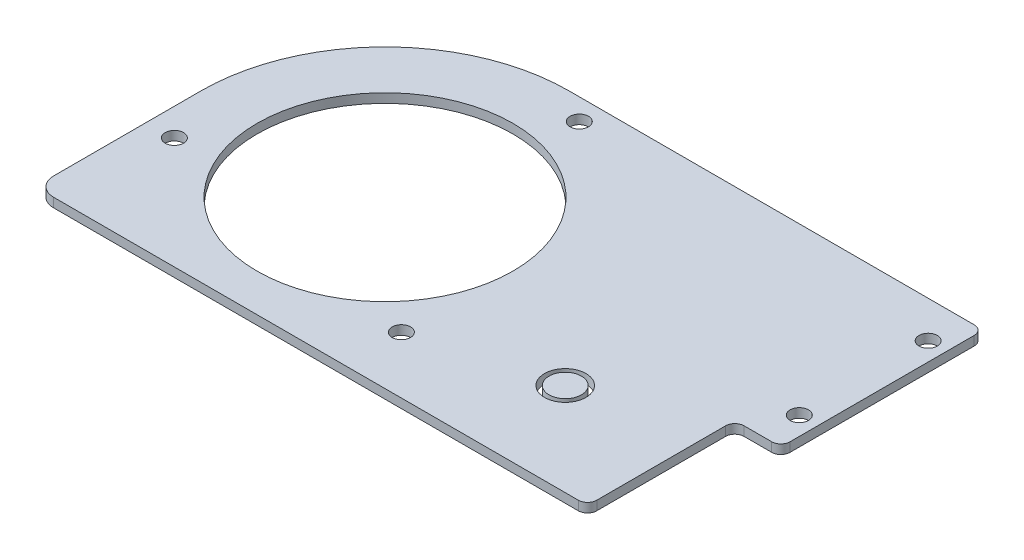
from build123d import *

# Parameters (mm, degrees)
SKETCH1_R           = 88.265
SKETCH1_R_2         = 6.35
BOSS_EXTRUDE1_DEPTH = 6.35
SKETCH6_R           = 14.2875
SKETCH6_R_2         = 11.176
CUT_EXTRUDE1_DEPTH  = 28.448


with BuildPart() as part:
    # Sketch1 → Boss-Extrude1 (new body)
    with BuildSketch(Plane(origin=(0, 0, 0), x_dir=(1, 0, 0), z_dir=(0, 1, 0))):
        with BuildLine():
            Line((279.4, 127), (0, 127))
            ThreePointArc((0, 127), (-89.802561211, 89.802561211), (-127, 0))
            Line((-127, 0), (-127, -101.6))
            ThreePointArc((-127, -101.6), (-123.280256121, -110.580256121), (-114.3, -114.3))
            Line((-114.3, -114.3), (247.65, -114.3))
            ThreePointArc((247.65, -114.3), (252.140128061, -112.440128061), (254, -107.95))
            Line((254, -107.95), (254, -19.05))
            ThreePointArc((254, -19.05), (255.859871939, -14.559871939), (260.35, -12.7))
            Line((260.35, -12.7), (279.4, -12.7))
            ThreePointArc((279.4, -12.7), (283.890128061, -10.840128061), (285.75, -6.35))
            Line((285.75, -6.35), (285.75, 120.65))
            ThreePointArc((285.75, 120.65), (283.890128061, 125.140128061), (279.4, 127))
        make_face()
        with Locations(Location((0, 0, 0), (0, 0, 270))):
            Circle(SKETCH1_R, mode=Mode.SUBTRACT)
        with Locations(Location((-108.072773191, -37.212440054, 0), (0, 0, 270))):
            Circle(SKETCH1_R_2, mode=Mode.SUBTRACT)
        with Locations(Location((21.809468172, 112.199987068, 0), (0, 0, 270))):
            Circle(SKETCH1_R_2, mode=Mode.SUBTRACT)
        with Locations(Location((86.263305019, -74.987547014, 0), (0, 0, 270))):
            Circle(SKETCH1_R_2, mode=Mode.SUBTRACT)
        with Locations(Location((273.05, 101.6, 0), (0, 0, 270))):
            Circle(SKETCH1_R_2, mode=Mode.SUBTRACT)
        with Locations(Location((273.05, 12.7, 0), (0, 0, 270))):
            Circle(SKETCH1_R_2, mode=Mode.SUBTRACT)
    extrude(amount=BOSS_EXTRUDE1_DEPTH)

    # Sketch6 → Cut-Extrude1 (cut)
    with BuildSketch(Plane(origin=(0, 0, 0), x_dir=(1, 0, 0), z_dir=(0, 1, 0))):
        with Locations(Location((174.61484, -50.292, 0), (0, 0, 90))):
            Circle(SKETCH6_R)
        with Locations(Location((174.61484, -50.292, 0), (0, 0, 90))):
            Circle(SKETCH6_R_2, mode=Mode.SUBTRACT)
    extrude(amount=CUT_EXTRUDE1_DEPTH, mode=Mode.SUBTRACT)


with BuildPart() as cut_extrude1_piece_1:
    # of the separate pieces the step leaves, piece 1, a body of its own (cut_extrude1_pieces)
    add(part.part.solids().sort_by_distance((279.4, 0, -127))[0])


with BuildPart() as cut_extrude1_piece_2:
    # of the separate pieces the step leaves, piece 2, a body of its own (cut_extrude1_pieces)
    add(part.part.solids().sort_by_distance((174.61484, 0, 39.116))[0])


solid = Compound([cut_extrude1_piece_1.part, cut_extrude1_piece_2.part])
